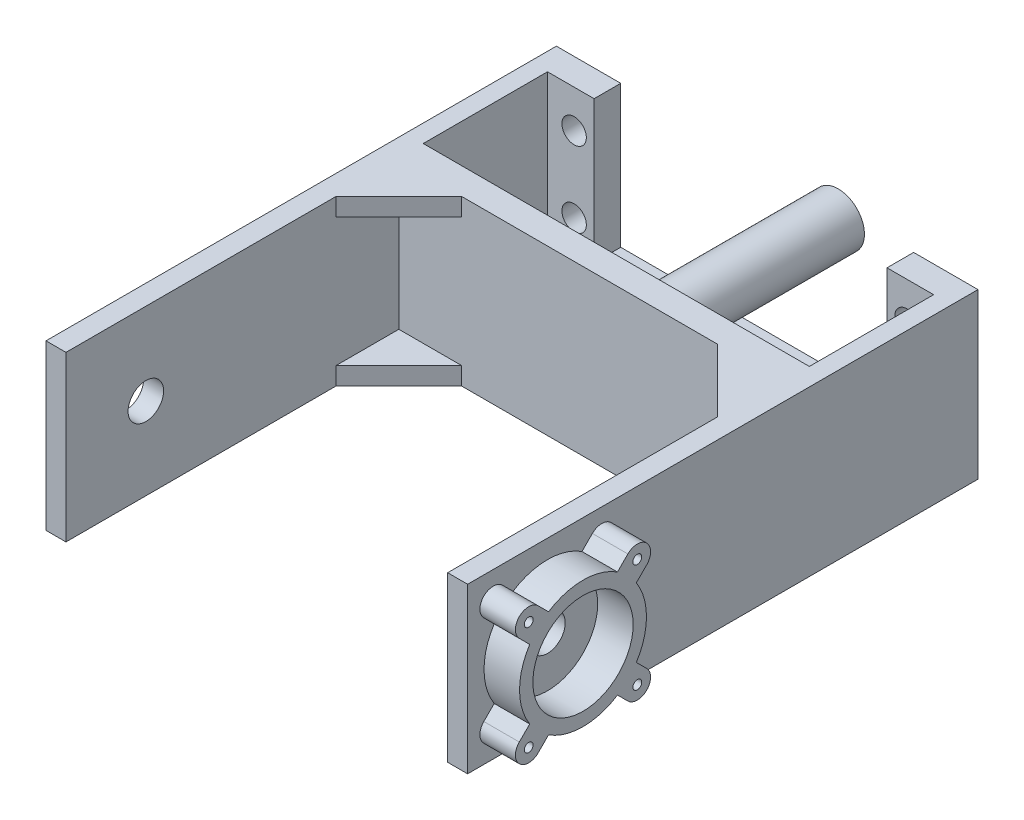
from build123d import *

# Parameters (mm, degrees)
SKETCH1_W            = 95
SKETCH1_H            = 40
BOSS_EXTRUDE1_DEPTH  = 5
SKETCH2_W            = 14.5
SKETCH2_H            = 6
BOSS_EXTRUDE2_DEPTH  = 32
SKETCH4_R            = 2.75
CUT_EXTRUDE1_DEPTH   = 6
BOSS_EXTRUDE5_DEPTH  = 32
SKETCH11_W           = 4.5
SKETCH11_H           = 37
BOSS_EXTRUDE6_DEPTH  = 75
SKETCH12_R           = 4
CUT_EXTRUDE3_DEPTH   = 110
BOSS_EXTRUDE9_DEPTH  = 4
SKETCH16_R           = 11.3
SKETCH16_R_2         = 1
BOSS_EXTRUDE11_DEPTH = 8
SKETCH17_R           = 5.912080619
BOSS_EXTRUDE12_DEPTH = 50


with BuildPart() as part:
    # Sketch1 → Boss-Extrude1 (new body)
    with BuildSketch(Plane(origin=(0, 0, 0), x_dir=(1, 0, 0), z_dir=(0, 1, 0))):
        Rectangle(SKETCH1_W, SKETCH1_H)
    extrude(amount=BOSS_EXTRUDE1_DEPTH)

    # Sketch2 → Boss-Extrude2 (add)
    with BuildSketch(Plane(origin=(0, 5, 0), x_dir=(1, 0, 0), z_dir=(0, 1, 0))):
        with Locations((-40.25, 17)):
            Rectangle(SKETCH2_W, SKETCH2_H)
        with Locations((40.25, 17)):
            Rectangle(SKETCH2_W, SKETCH2_H)
    extrude(amount=BOSS_EXTRUDE2_DEPTH)

    # Sketch4 → Cut-Extrude1 (cut)
    with BuildSketch(Plane(origin=(0, 0, -20), x_dir=(-1, 0, 0), z_dir=(0, 0, -1))):
        with Locations((37.5, 11.5)):
            Circle(SKETCH4_R)
        with Locations((37.5, 28.5)):
            Circle(SKETCH4_R)
        with Locations(Location((-37.5, 28.5, 0), (0, 0, 180))):
            Circle(SKETCH4_R)
        with Locations(Location((-37.5, 11.5, 0), (0, 0, 180))):
            Circle(SKETCH4_R)
    extrude(amount=-CUT_EXTRUDE1_DEPTH, mode=Mode.SUBTRACT)

    # Sketch10 → Boss-Extrude5 (add)
    with BuildSketch(Plane(origin=(0, 5, 0), x_dir=(1, 0, 0), z_dir=(0, 1, 0))):
        Polygon((-47.5, -14), (-47.5, -20), (-43.5, -20), (43.5, -20), (47.5, -20), (47.5, -19), (47.5, 14), (43.5, 14), (43.5, -14), (-43.5, -14), (-43.5, 14), (-47.5, 14), align=None)
    extrude(amount=BOSS_EXTRUDE5_DEPTH)

    # Sketch11 → Boss-Extrude6 (add)
    with BuildSketch(Plane.XY.offset(20)):
        with Locations((-45.25, 18.5)):
            Rectangle(SKETCH11_W, SKETCH11_H)
        with Locations((45.25, 18.5)):
            Rectangle(SKETCH11_W, SKETCH11_H)
    extrude(amount=BOSS_EXTRUDE6_DEPTH)

    # Sketch12 → Cut-Extrude3 (cut)
    with BuildSketch(Plane.ZY.offset(47.5)):
        with Locations((77, 18.5)):
            Circle(SKETCH12_R)
    extrude(amount=-CUT_EXTRUDE3_DEPTH, mode=Mode.SUBTRACT)

    # Sketch15 → Boss-Extrude9 (add)
    with BuildSketch(Plane(origin=(0, 37, 0), x_dir=(1, 0, 0), z_dir=(0, 1, 0))):
        Polygon((28.857864376, -20), (43, -34.142135624), (43, -20), align=None)
        Polygon((-28.857864376, -20), (-43, -20), (-43, -34.142135624), align=None)
    boss_extrude9 = extrude(amount=-BOSS_EXTRUDE9_DEPTH)

    # Mirror2: Boss-Extrude9 across plane
    add(boss_extrude9.mirror(Plane.ZX.offset(18.5)))

    # Sketch16 → Boss-Extrude11 (add)
    with BuildSketch(Plane(origin=(47.5, 0, 0), x_dir=(0, 0, -1), z_dir=(1, 0, 0))):
        with BuildLine():
            Line((-66.888373029, 4.145732342), (-69.234713241, 6.492072554))
            ThreePointArc((-69.234713241, 6.492072554), (-77, 4.2), (-84.765286759, 6.492072554))
            Line((-84.765286759, 6.492072554), (-87.111626971, 4.145732342))
            ThreePointArc((-87.111626971, 4.145732342), (-91.354267658, 4.145732342), (-91.354267658, 8.388373029))
            Line((-91.354267658, 8.388373029), (-89.007927446, 10.734713241))
            ThreePointArc((-89.007927446, 10.734713241), (-91.3, 18.5), (-89.007927446, 26.265286759))
            Line((-89.007927446, 26.265286759), (-91.354267658, 28.611626971))
            ThreePointArc((-91.354267658, 28.611626971), (-91.354267658, 32.854267658), (-87.111626971, 32.854267658))
            Line((-87.111626971, 32.854267658), (-84.765286759, 30.507927446))
            ThreePointArc((-84.765286759, 30.507927446), (-77, 32.8), (-69.234713241, 30.507927446))
            Line((-69.234713241, 30.507927446), (-66.888373029, 32.854267658))
            ThreePointArc((-66.888373029, 32.854267658), (-62.645732342, 32.854267658), (-62.645732342, 28.611626971))
            Line((-62.645732342, 28.611626971), (-64.992072554, 26.265286759))
            ThreePointArc((-64.992072554, 26.265286759), (-62.7, 18.5), (-64.992072554, 10.734713241))
            Line((-64.992072554, 10.734713241), (-62.645732342, 8.388373029))
            ThreePointArc((-62.645732342, 8.388373029), (-62.645732342, 4.145732342), (-66.888373029, 4.145732342))
        make_face()
        with Locations((-77, 18.5)):
            Circle(SKETCH16_R, mode=Mode.SUBTRACT)
        with Locations((-64.767052685, 6.267052685)):
            Circle(SKETCH16_R_2, mode=Mode.SUBTRACT)
        with Locations((-89.232947315, 6.267052685)):
            Circle(SKETCH16_R_2, mode=Mode.SUBTRACT)
        with Locations((-89.232947315, 30.732947315)):
            Circle(SKETCH16_R_2, mode=Mode.SUBTRACT)
        with Locations((-64.767052685, 30.732947315)):
            Circle(SKETCH16_R_2, mode=Mode.SUBTRACT)
    extrude(amount=BOSS_EXTRUDE11_DEPTH)

    # Sketch17 → Boss-Extrude12 (add)
    with BuildSketch(Plane(origin=(0, 0, 14), x_dir=(-1, 0, 0), z_dir=(0, 0, -1))):
        with Locations((0, 19)):
            Circle(SKETCH17_R)
    extrude(amount=BOSS_EXTRUDE12_DEPTH)


solid = part.part
